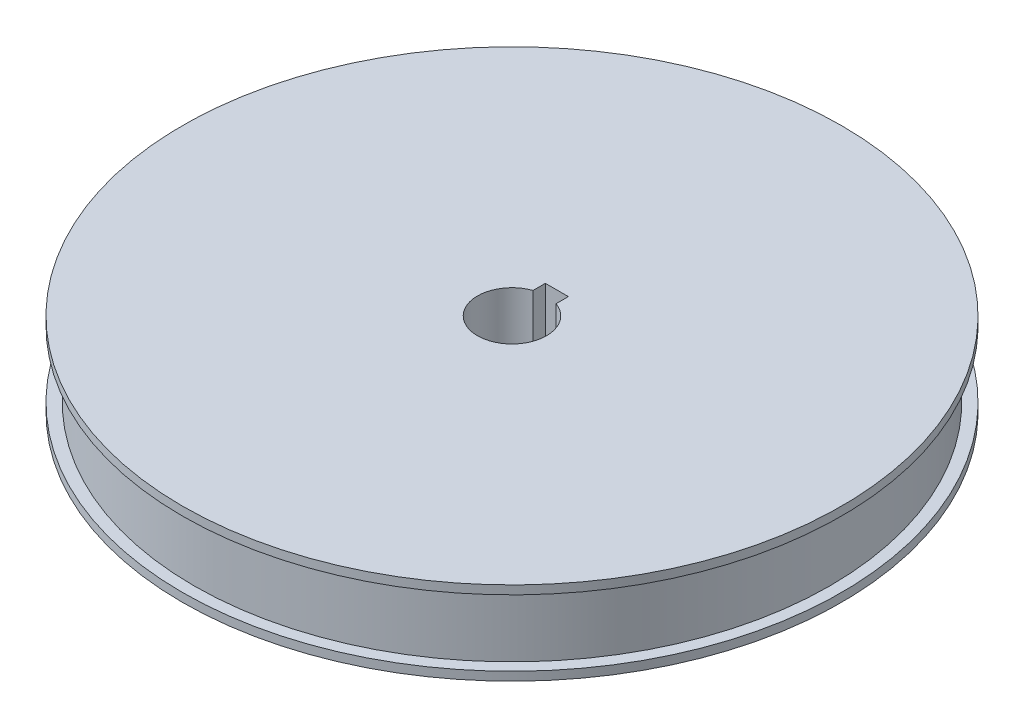
from build123d import *

# Parameters (mm, degrees)
SKETCH2_W          = 4
SKETCH2_H          = 4.3
CUT_EXTRUDE1_DEPTH = 83.314543369


with BuildPart() as part:
    # Sketch1 → Revolve1 (revolve)
    with BuildSketch(Plane(origin=(0, 0, 0), x_dir=(0, 0, -1), z_dir=(1, 0, 0)), mode=Mode.PRIVATE) as revolve1_sk:
        Polygon((55.295, -5.75), (55.295, 5.75), (57.295, 5.75), (57.295, 7.25), (6, 7.25), (6, -7.25), (57.295, -7.25), (57.295, -5.75), align=None)
    revolve(revolve1_sk.sketch.rotate(Axis((0, 10.31552251, 0), (0, -1, 0)), 180), axis=Axis((0, 10.31552251, 0), (0, -1, 0)))

    # Sketch2 → Cut-Extrude1 (cut, through all)
    with BuildSketch(Plane(origin=(0, 7.25, 0), x_dir=(1, 0, 0), z_dir=(0, 1, 0))):
        with Locations((0, 5.65)):
            Rectangle(SKETCH2_W, SKETCH2_H)
    extrude(amount=-CUT_EXTRUDE1_DEPTH, mode=Mode.SUBTRACT)


solid = part.part
